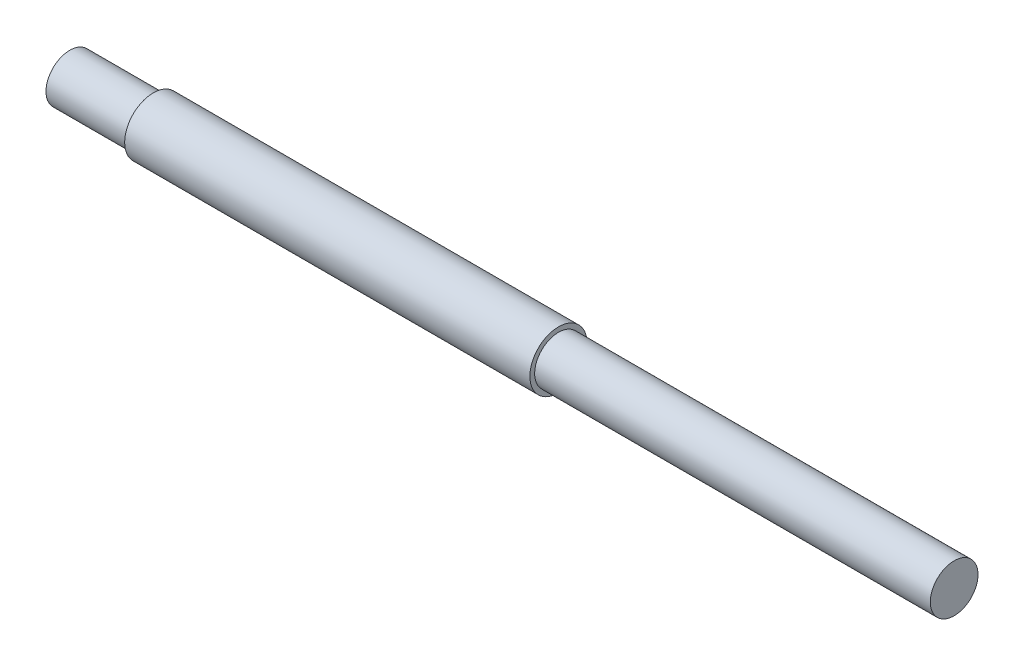
from build123d import *

# Parameters (mm, degrees)
ESQUISSE2_W             = 185.5
ESQUISSE2_H             = 6
ESQUISSE3_R             = 6
ESQUISSE3_R_2           = 5
ENL_V_MAT_EXTRU_1_DEPTH = 83
ENL_V_START             = -17.5
ENL_V_MAT_EXTRU_2_DEPTH = 17.5


with BuildPart() as part:
    # Esquisse2 → Révolution2 (revolve)
    with BuildSketch(Plane(origin=(0, 0, 0), x_dir=(1, 0, 0), z_dir=(0, 1, 0))):
        with Locations((92.75, 3)):
            Rectangle(ESQUISSE2_W, ESQUISSE2_H)
    revolve(axis=Axis((0, 0, -6), (1, 0, 0)))

    # Esquisse3 → Enlèv. mat.-Extru.1 (cut)
    with BuildSketch(Plane(origin=(185.5, 0, 0), x_dir=(0, 0, -1), z_dir=(1, 0, 0))):
        with Locations(Location((6, 0, 0), (0, 0, 180))):
            Circle(ESQUISSE3_R)
        with Locations((6, 0)):
            Circle(ESQUISSE3_R_2, mode=Mode.SUBTRACT)
    extrude(amount=-ENL_V_MAT_EXTRU_1_DEPTH, mode=Mode.SUBTRACT)

    # Esquisse5 → Enlèv. mat.-Extru.2 (cut)
    with BuildSketch(Plane.ZY.offset(ENL_V_START)):
        with BuildLine():
            ThreePointArc((-11, 0), (-6, 5), (-1, 0))
            Line((-1, 0), (0, 0))
            ThreePointArc((0, 0), (-6, 6), (-12, 0))
            Line((-12, 0), (-11, 0))
        make_face()
        with BuildLine():
            Line((0, 0), (-1, 0))
            ThreePointArc((-1, 0), (-6, -5), (-11, 0))
            Line((-11, 0), (-12, 0))
            ThreePointArc((-12, 0), (-6, -6), (0, 0))
        make_face()
    extrude(amount=ENL_V_MAT_EXTRU_2_DEPTH, mode=Mode.SUBTRACT)


solid = part.part
